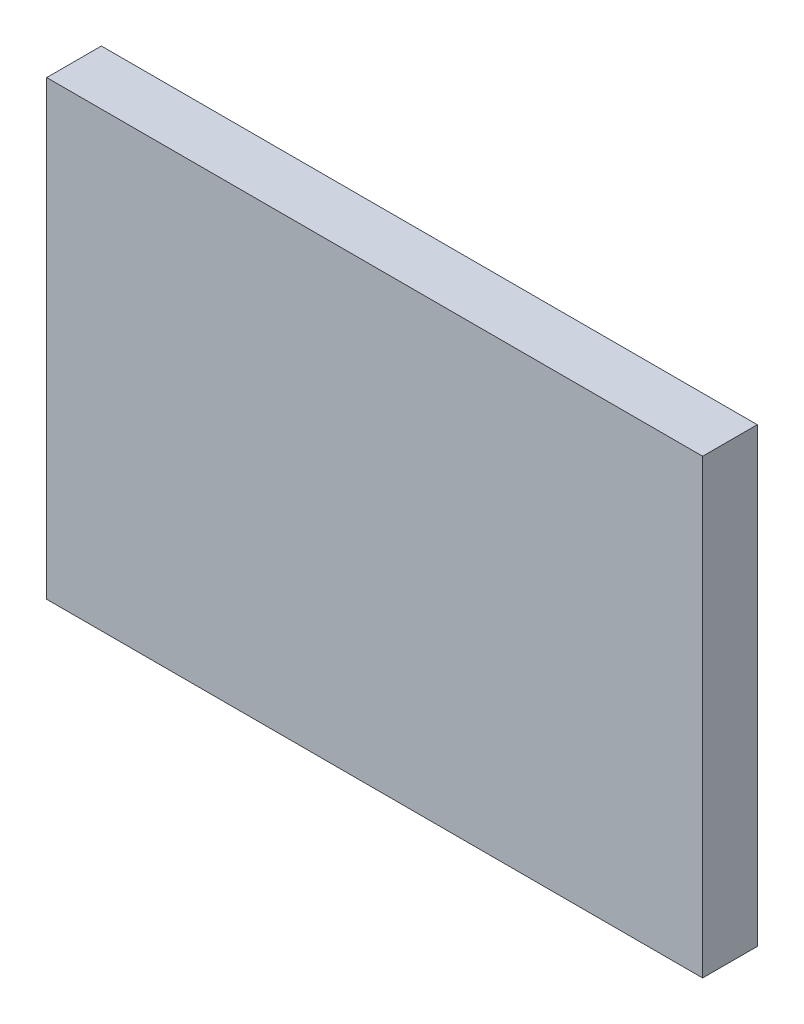
from build123d import *

# Parameters (mm, degrees)
SKETCH1_W           = 45.72
SKETCH1_H           = 31.496
BOSS_EXTRUDE1_DEPTH = 3.81


with BuildPart() as part:
    # Sketch1 → Boss-Extrude1 (new body)
    with BuildSketch(Plane.XY):
        Rectangle(SKETCH1_W, SKETCH1_H)
    extrude(amount=BOSS_EXTRUDE1_DEPTH)


solid = part.part
